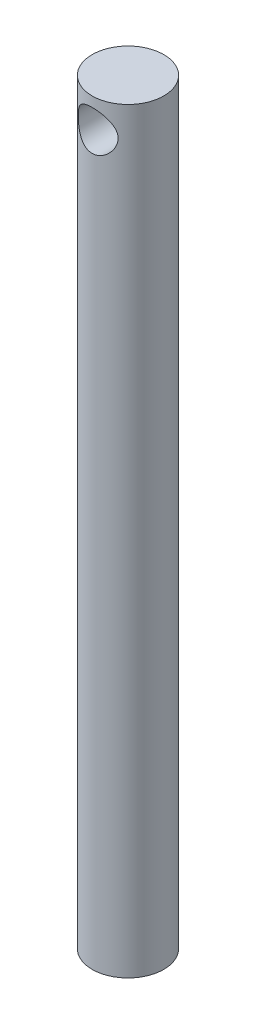
from build123d import *

# Parameters (mm, degrees)
SZKIC1_R                        = 0.9
DODANIE_WYCI_GNI_CIE1_DEPTH     = 19
WYTNIJ_WYCI_GNI_CIE1_DEPTH      = 20.042583858
WYTNIJ_WYCI_GNI_CIE1_DEPTH_BACK = 20.042583858
SZKIC2_R                        = 0.5


with BuildPart() as part:
    # Szkic1 → Dodanie-wyciągnięcie1 (new body)
    with BuildSketch(Plane(origin=(0, 0, 0), x_dir=(1, 0, 0), z_dir=(0, 1, 0))):
        with Locations(Location((0, 0, 0), (0, 0, 270))):
            Circle(SZKIC1_R)
    extrude(amount=DODANIE_WYCI_GNI_CIE1_DEPTH)

    # Szkic2 → Wytnij-wyciągnięcie1 (cut, two sides: drawn at the far end of the back side and taken through both)
    with BuildSketch(Plane.XY.offset(-WYTNIJ_WYCI_GNI_CIE1_DEPTH_BACK)):
        with Locations(Location((0, 18.25, 0), (0, 0, 89.999999997))):
            Circle(SZKIC2_R)
    extrude(amount=WYTNIJ_WYCI_GNI_CIE1_DEPTH + WYTNIJ_WYCI_GNI_CIE1_DEPTH_BACK, mode=Mode.SUBTRACT)


solid = part.part
